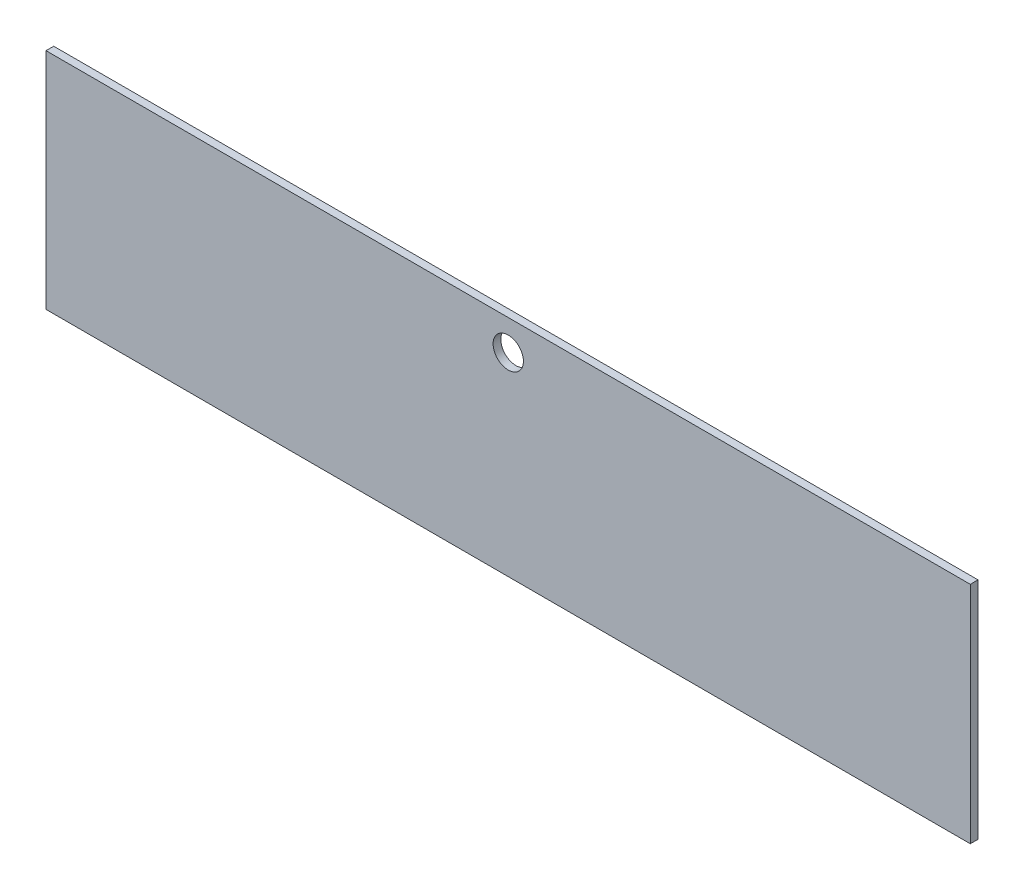
from build123d import *

# Parameters (mm, degrees)
BOSS_EXTRUDE1_DEPTH = 6.35
SKETCH2_R           = 12.5
CUT_EXTRUDE1_DEPTH  = 414.4708728


with BuildPart() as part:
    # Sketch1 → Boss-Extrude1 (new body)
    with BuildSketch(Plane.XY):
        Polygon((-381.094249826, -159.734501203), (-381.094249826, 25), (380.905750174, 25), (380.905750174, -160.265445134), align=None)
    extrude(amount=BOSS_EXTRUDE1_DEPTH)

    # Sketch2 → Cut-Extrude1 (cut, through all)
    with BuildSketch(Plane.XY.offset(6.35)):
        Circle(SKETCH2_R)
    extrude(amount=-CUT_EXTRUDE1_DEPTH, mode=Mode.SUBTRACT)


solid = part.part
